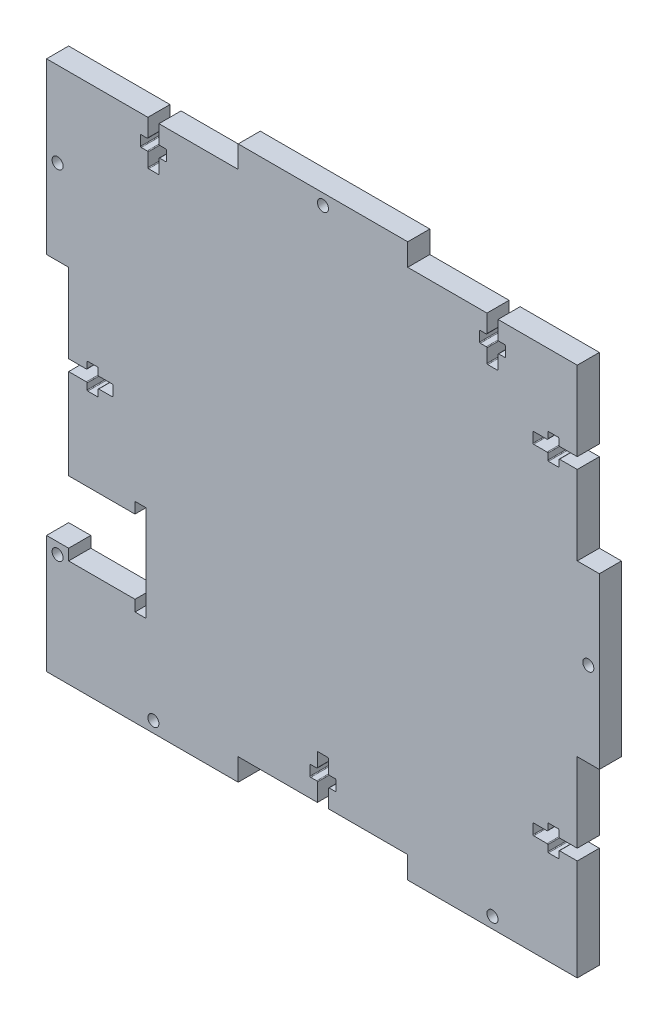
from build123d import *

# Parameters (mm, degrees)
BOX_SIDE_DEPTH       = 6
SKETCH2_R            = 1.5
SCREW_CUT_OUTS_DEPTH = 107.235587258
CUT_EXTRUDE1_DEPTH   = 107.235587258


with BuildPart() as part:
    # Sketch1 → Box Side (new body)
    with BuildSketch(Plane.XY):
        Polygon((-69, 69), (-23, 69), (-23, 75), (23, 75), (23, 69), (69, 69), (69, 23), (75, 23), (75, -23), (69, -23), (69, -69), (69, -75), (23, -75), (23, -69), (-23, -69), (-23, -75), (-69, -75), (-75, -75), (-75, -69), (-75, -23), (-69, -23), (-69, 23), (-75, 23), (-75, 69), align=None)
    extrude(amount=BOX_SIDE_DEPTH)

    # Sketch2 → Screw Cut-outs (cut, through all)
    with BuildSketch(Plane.XY.offset(6)):
        with Locations((0, 72)):
            Circle(SKETCH2_R)
        with Locations(Location((72, 0, 0), (0, 0, 180))):
            Circle(SKETCH2_R)
        with Locations((-46, -72)):
            Circle(SKETCH2_R)
        with Locations(Location((46, -72, 0), (0, 0, 180))):
            Circle(SKETCH2_R)
        with Locations((-72, 46)):
            Circle(SKETCH2_R)
        with Locations(Location((-72, -46, 0), (0, 0, 180))):
            Circle(SKETCH2_R)
        with BuildLine():
            Line((-44.5, 69), (-44.5, 64.2))
            ThreePointArc((-44.5, 64.2), (-44.441421356, 64.058578644), (-44.3, 64))
            Line((-44.3, 64), (-42.7, 64))
            ThreePointArc((-42.7, 64), (-42.558578644, 63.941421356), (-42.5, 63.8))
            Line((-42.5, 63.8), (-42.5, 61.2))
            ThreePointArc((-42.5, 61.2), (-42.558578644, 61.058578644), (-42.7, 61))
            Line((-42.7, 61), (-44.3, 61))
            ThreePointArc((-44.3, 61), (-44.441421356, 60.941421356), (-44.5, 60.8))
            Line((-44.5, 60.8), (-44.5, 57.2))
            ThreePointArc((-44.5, 57.2), (-44.558578644, 57.058578644), (-44.7, 57))
            Line((-44.7, 57), (-47.3, 57))
            ThreePointArc((-47.3, 57), (-47.441421356, 57.058578644), (-47.5, 57.2))
            Line((-47.5, 57.2), (-47.5, 60.8))
            ThreePointArc((-47.5, 60.8), (-47.558578644, 60.941421356), (-47.7, 61))
            Line((-47.7, 61), (-49.3, 61))
            ThreePointArc((-49.3, 61), (-49.441421356, 61.058578644), (-49.5, 61.2))
            Line((-49.5, 61.2), (-49.5, 63.8))
            ThreePointArc((-49.5, 63.8), (-49.441421356, 63.941421356), (-49.3, 64))
            Line((-49.3, 64), (-47.7, 64))
            ThreePointArc((-47.7, 64), (-47.558578644, 64.058578644), (-47.5, 64.2))
            Line((-47.5, 64.2), (-47.5, 69))
            Line((-47.5, 69), (-44.5, 69))
        make_face()
        with BuildLine():
            Line((47.5, 69), (47.5, 64.2))
            ThreePointArc((47.5, 64.2), (47.558578644, 64.058578644), (47.7, 64))
            Line((47.7, 64), (49.3, 64))
            ThreePointArc((49.3, 64), (49.441421356, 63.941421356), (49.5, 63.8))
            Line((49.5, 63.8), (49.5, 61.2))
            ThreePointArc((49.5, 61.2), (49.441421356, 61.058578644), (49.3, 61))
            Line((49.3, 61), (47.7, 61))
            ThreePointArc((47.7, 61), (47.558578644, 60.941421356), (47.5, 60.8))
            Line((47.5, 60.8), (47.5, 57.2))
            ThreePointArc((47.5, 57.2), (47.441421356, 57.058578644), (47.3, 57))
            Line((47.3, 57), (44.7, 57))
            ThreePointArc((44.7, 57), (44.558578644, 57.058578644), (44.5, 57.2))
            Line((44.5, 57.2), (44.5, 60.8))
            ThreePointArc((44.5, 60.8), (44.441421356, 60.941421356), (44.3, 61))
            Line((44.3, 61), (42.7, 61))
            ThreePointArc((42.7, 61), (42.558578644, 61.058578644), (42.5, 61.2))
            Line((42.5, 61.2), (42.5, 63.8))
            ThreePointArc((42.5, 63.8), (42.558578644, 63.941421356), (42.7, 64))
            Line((42.7, 64), (44.3, 64))
            ThreePointArc((44.3, 64), (44.441421356, 64.058578644), (44.5, 64.2))
            Line((44.5, 64.2), (44.5, 69))
            Line((44.5, 69), (47.5, 69))
        make_face()
        with BuildLine():
            Line((69, 44.5), (64.2, 44.5))
            ThreePointArc((64.2, 44.5), (64.058578644, 44.441421356), (64, 44.3))
            Line((64, 44.3), (64, 42.7))
            ThreePointArc((64, 42.7), (63.941421356, 42.558578644), (63.8, 42.5))
            Line((63.8, 42.5), (61.2, 42.5))
            ThreePointArc((61.2, 42.5), (61.058578644, 42.558578644), (61, 42.7))
            Line((61, 42.7), (61, 44.3))
            ThreePointArc((61, 44.3), (60.941421356, 44.441421356), (60.8, 44.5))
            Line((60.8, 44.5), (57.2, 44.5))
            ThreePointArc((57.2, 44.5), (57.058578644, 44.558578644), (57, 44.7))
            Line((57, 44.7), (57, 47.3))
            ThreePointArc((57, 47.3), (57.058578644, 47.441421356), (57.2, 47.5))
            Line((57.2, 47.5), (60.8, 47.5))
            ThreePointArc((60.8, 47.5), (60.941421356, 47.558578644), (61, 47.7))
            Line((61, 47.7), (61, 49.3))
            ThreePointArc((61, 49.3), (61.058578644, 49.441421356), (61.2, 49.5))
            Line((61.2, 49.5), (63.8, 49.5))
            ThreePointArc((63.8, 49.5), (63.941421356, 49.441421356), (64, 49.3))
            Line((64, 49.3), (64, 47.7))
            ThreePointArc((64, 47.7), (64.058578644, 47.558578644), (64.2, 47.5))
            Line((64.2, 47.5), (69, 47.5))
            Line((69, 47.5), (69, 44.5))
        make_face()
        with BuildLine():
            Line((69, -47.5), (64.2, -47.5))
            ThreePointArc((64.2, -47.5), (64.058578644, -47.558578644), (64, -47.7))
            Line((64, -47.7), (64, -49.3))
            ThreePointArc((64, -49.3), (63.941421356, -49.441421356), (63.8, -49.5))
            Line((63.8, -49.5), (61.2, -49.5))
            ThreePointArc((61.2, -49.5), (61.058578644, -49.441421356), (61, -49.3))
            Line((61, -49.3), (61, -47.7))
            ThreePointArc((61, -47.7), (60.941421356, -47.558578644), (60.8, -47.5))
            Line((60.8, -47.5), (57.2, -47.5))
            ThreePointArc((57.2, -47.5), (57.058578644, -47.441421356), (57, -47.3))
            Line((57, -47.3), (57, -44.7))
            ThreePointArc((57, -44.7), (57.058578644, -44.558578644), (57.2, -44.5))
            Line((57.2, -44.5), (60.8, -44.5))
            ThreePointArc((60.8, -44.5), (60.941421356, -44.441421356), (61, -44.3))
            Line((61, -44.3), (61, -42.7))
            ThreePointArc((61, -42.7), (61.058578644, -42.558578644), (61.2, -42.5))
            Line((61.2, -42.5), (63.8, -42.5))
            ThreePointArc((63.8, -42.5), (63.941421356, -42.558578644), (64, -42.7))
            Line((64, -42.7), (64, -44.3))
            ThreePointArc((64, -44.3), (64.058578644, -44.441421356), (64.2, -44.5))
            Line((64.2, -44.5), (69, -44.5))
            Line((69, -44.5), (69, -47.5))
        make_face()
        with BuildLine():
            Line((-1.5, -69), (1.5, -69))
            Line((1.5, -69), (1.5, -64.2))
            ThreePointArc((1.5, -64.2), (1.558578644, -64.058578644), (1.7, -64))
            Line((1.7, -64), (3.3, -64))
            ThreePointArc((3.3, -64), (3.441421356, -63.941421356), (3.5, -63.8))
            Line((3.5, -63.8), (3.5, -61.2))
            ThreePointArc((3.5, -61.2), (3.441421356, -61.058578644), (3.3, -61))
            Line((3.3, -61), (1.7, -61))
            ThreePointArc((1.7, -61), (1.558578644, -60.941421356), (1.5, -60.8))
            Line((1.5, -60.8), (1.5, -57.2))
            ThreePointArc((1.5, -57.2), (1.441421356, -57.058578644), (1.3, -57))
            Line((1.3, -57), (-1.3, -57))
            ThreePointArc((-1.3, -57), (-1.441421356, -57.058578644), (-1.5, -57.2))
            Line((-1.5, -57.2), (-1.5, -60.8))
            ThreePointArc((-1.5, -60.8), (-1.558578644, -60.941421356), (-1.7, -61))
            Line((-1.7, -61), (-3.3, -61))
            ThreePointArc((-3.3, -61), (-3.441421356, -61.058578644), (-3.5, -61.2))
            Line((-3.5, -61.2), (-3.5, -63.8))
            ThreePointArc((-3.5, -63.8), (-3.441421356, -63.941421356), (-3.3, -64))
            Line((-3.3, -64), (-1.7, -64))
            ThreePointArc((-1.7, -64), (-1.558578644, -64.058578644), (-1.5, -64.2))
            Line((-1.5, -64.2), (-1.5, -69))
        make_face()
        with BuildLine():
            Line((-69, -1.5), (-64.2, -1.5))
            ThreePointArc((-64.2, -1.5), (-64.058578644, -1.558578644), (-64, -1.7))
            Line((-64, -1.7), (-64, -3.3))
            ThreePointArc((-64, -3.3), (-63.941421356, -3.441421356), (-63.8, -3.5))
            Line((-63.8, -3.5), (-61.2, -3.5))
            ThreePointArc((-61.2, -3.5), (-61.058578644, -3.441421356), (-61, -3.3))
            Line((-61, -3.3), (-61, -1.7))
            ThreePointArc((-61, -1.7), (-60.941421356, -1.558578644), (-60.8, -1.5))
            Line((-60.8, -1.5), (-57.2, -1.5))
            ThreePointArc((-57.2, -1.5), (-57.058578644, -1.441421356), (-57, -1.3))
            Line((-57, -1.3), (-57, 1.3))
            ThreePointArc((-57, 1.3), (-57.058578644, 1.441421356), (-57.2, 1.5))
            Line((-57.2, 1.5), (-60.8, 1.5))
            ThreePointArc((-60.8, 1.5), (-60.941421356, 1.558578644), (-61, 1.7))
            Line((-61, 1.7), (-61, 3.3))
            ThreePointArc((-61, 3.3), (-61.058578644, 3.441421356), (-61.2, 3.5))
            Line((-61.2, 3.5), (-63.8, 3.5))
            ThreePointArc((-63.8, 3.5), (-63.941421356, 3.441421356), (-64, 3.3))
            Line((-64, 3.3), (-64, 1.7))
            ThreePointArc((-64, 1.7), (-64.058578644, 1.558578644), (-64.2, 1.5))
            Line((-64.2, 1.5), (-69, 1.5))
            Line((-69, 1.5), (-69, -1.5))
        make_face()
    extrude(amount=-SCREW_CUT_OUTS_DEPTH, mode=Mode.SUBTRACT)

    # Sketch3 → Cut-Extrude1 (cut, through all)
    with BuildSketch(Plane.XY.offset(6)):
        Polygon((-51, -46), (-51, -49), (-48, -49), (-48, -23), (-51, -23), (-51, -26), (-69, -26), (-69, -23), (-75, -23), (-75, -43), (-69, -43), (-69, -46), align=None)
    extrude(amount=-CUT_EXTRUDE1_DEPTH, mode=Mode.SUBTRACT)


solid = part.part
